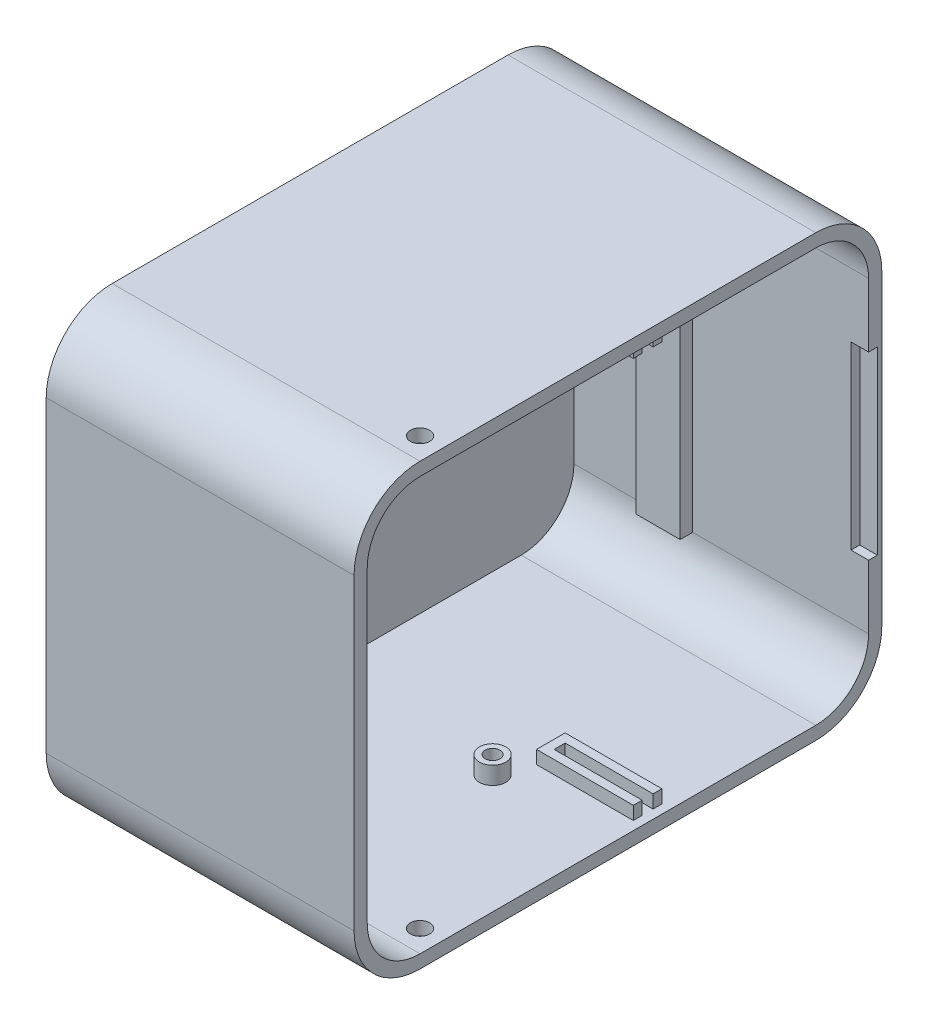
from build123d import *

# Parameters (mm, degrees)
SKETCH1_W            = 120
SKETCH1_H            = 100
BOSS_EXTRUDE2_DEPTH  = 70
FILLET1_R            = 15
SHELL2_T             = -3
SKETCH3_W            = 4
SKETCH3_H            = 41
CUT_EXTRUDE1_DEPTH   = 2
SKETCH4_W            = 10
SKETCH4_H            = 70
BOSS_EXTRUDE3_DEPTH  = 2.85
SKETCH16_R           = 3.5
SKETCH16_R_2         = 2.2
SKETCH16_R_3         = 1.5
BOSS_EXTRUDE5_DEPTH  = 5
BOSS_EXTRUDE6_DEPTH  = 3
SKETCH23_R           = 3
SKETCH23_R_2         = 1.7
BOSS_EXTRUDE10_DEPTH = 4
SKETCH6_R            = 2.2
CUT_EXTRUDE2_DEPTH   = 137.014705087
SKETCH24_R           = 4
CUT_EXTRUDE3_DEPTH   = 3


with BuildPart() as part:
    # Sketch1 → Boss-Extrude2 (new body)
    with BuildSketch(Plane(origin=(0, 0, 0), x_dir=(0, 0, -1), z_dir=(1, 0, 0))):
        Rectangle(SKETCH1_W, SKETCH1_H)
    extrude(amount=BOSS_EXTRUDE2_DEPTH)

    # Fillet1
    fillet1_edges = [part.edges().sort_by_distance(p)[0] for p in [
        (35, -50, -60),
        (35, -50, 60),
        (35, 50, 60),
        (35, 50, -60),
    ]]
    fillet(fillet1_edges, radius=FILLET1_R)

    # Shell2
    shell2_openings = [part.faces().sort_by_distance(p)[0] for p in [
        (70, 0, 0),
    ]]
    offset(amount=SHELL2_T, openings=shell2_openings, kind=Kind.INTERSECTION)

    # Sketch3 → Cut-Extrude1 (cut)
    with BuildSketch(Plane.XY.offset(-57)):
        with Locations((68, 0)):
            Rectangle(SKETCH3_W, SKETCH3_H)
    extrude(amount=-CUT_EXTRUDE1_DEPTH, mode=Mode.SUBTRACT)

    # Sketch4 → Boss-Extrude3 (add)
    with BuildSketch(Plane.XY.offset(-57)):
        with Locations((25, 0)):
            Rectangle(SKETCH4_W, SKETCH4_H)
    extrude(amount=BOSS_EXTRUDE3_DEPTH)

    # Sketch16 → Boss-Extrude5 (add)
    # profile 1 of 4: a face of its own
    with BuildSketch(Plane(origin=(3, 0, 0), x_dir=(0, 0, -1), z_dir=(1, 0, 0))):
        with Locations((1.5, -29.8)):
            Circle(SKETCH16_R)
        with Locations((1.5, -29.8)):
            Circle(SKETCH16_R_2, mode=Mode.SUBTRACT)
    # profile 2 of 4: a face of its own
    with BuildSketch(Plane(origin=(3, 0, 0), x_dir=(0, 0, -1), z_dir=(1, 0, 0))):
        with Locations((-0.4, 36.2)):
            Circle(SKETCH16_R)
        with Locations((-0.4, 36.2)):
            Circle(SKETCH16_R_2, mode=Mode.SUBTRACT)
    # profile 3 of 4: a face of its own
    with BuildSketch(Plane(origin=(3, 0, 0), x_dir=(0, 0, -1), z_dir=(1, 0, 0))):
        with Locations((-38, 35)):
            Circle(SKETCH16_R_3)
    # profile 4 of 4: a face of its own
    with BuildSketch(Plane(origin=(3, 0, 0), x_dir=(0, 0, -1), z_dir=(1, 0, 0))):
        with Locations((-41.675568993, -27.374268476)):
            Circle(SKETCH16_R_3)
    extrude(amount=BOSS_EXTRUDE5_DEPTH)

    # Sketch15 → Boss-Extrude6 (add)
    with BuildSketch(Plane.XZ.offset(-47)):
        Polygon((46, -5.5), (68, -5.5), (68, -7.5), (48, -7.5), (48, -10), (68, -10), (68, -12), (46, -12), align=None)
    boss_extrude6 = extrude(amount=BOSS_EXTRUDE6_DEPTH)

    # Mirror1: Boss-Extrude6 across plane
    add(boss_extrude6.mirror(Plane.ZX))

    # Sketch23 → Boss-Extrude10 (add)
    # profile 1 of 2: a face of its own
    with BuildSketch(Plane(origin=(0, -47, 0), x_dir=(1, 0, 0), z_dir=(0, 1, 0))):
        with Locations(Location((43, -1.5, 0), (0, 0, 270))):
            Circle(SKETCH23_R)
        with Locations(Location((43, -1.5, 0), (0, 0, 270))):
            Circle(SKETCH23_R_2, mode=Mode.SUBTRACT)
    # profile 2 of 2: a face of its own
    with BuildSketch(Plane(origin=(0, -47, 0), x_dir=(1, 0, 0), z_dir=(0, 1, 0))):
        with Locations(Location((28, -32.5, 0), (0, 0, 270))):
            Circle(SKETCH23_R)
        with Locations(Location((28, -32.5, 0), (0, 0, 270))):
            Circle(SKETCH23_R_2, mode=Mode.SUBTRACT)
    extrude(amount=BOSS_EXTRUDE10_DEPTH)

    # Sketch6 → Cut-Extrude2 (cut, through all)
    with BuildSketch(Plane.XZ.offset(50)):
        with Locations(Location((65, 40, 0), (0, 0, 270))):
            Circle(SKETCH6_R)
    extrude(amount=-CUT_EXTRUDE2_DEPTH, mode=Mode.SUBTRACT)

    # Sketch24 → Cut-Extrude3 (cut)
    with BuildSketch(Plane(origin=(3, 0, 0), x_dir=(0, 0, -1), z_dir=(1, 0, 0))):
        with Locations((-10, 10)):
            Circle(SKETCH24_R)
        with Locations((10, 10)):
            Circle(SKETCH24_R)
        with Locations((-10, -10)):
            Circle(SKETCH24_R)
        with Locations((10, -10)):
            Circle(SKETCH24_R)
    extrude(amount=-CUT_EXTRUDE3_DEPTH, mode=Mode.SUBTRACT)


solid = part.part
